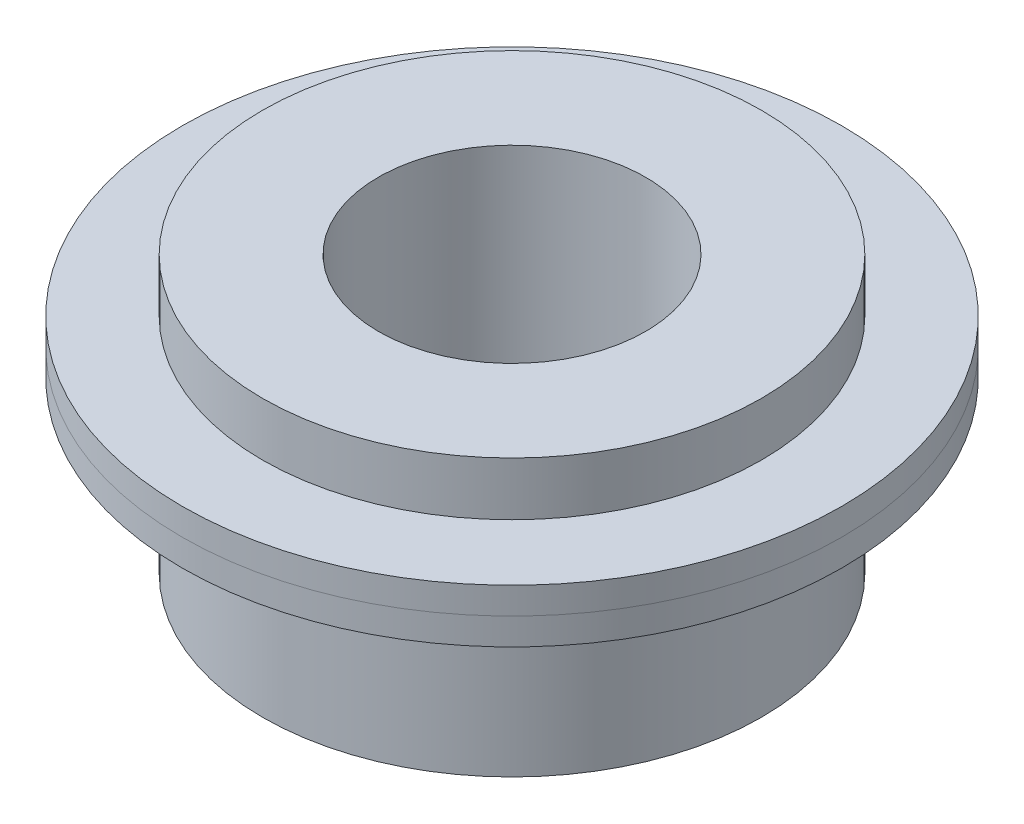
from build123d import *

# Parameters (mm, degrees)
SKETCH2_R           = 18.5
SKETCH2_R_2         = 14
BOSS_EXTRUDE1_DEPTH = 1.5


with BuildPart() as part:
    # Sketch1 → Revolve1 (revolve)
    with BuildSketch(Plane.XY, mode=Mode.PRIVATE) as revolve1_sk:
        Polygon((-7.5, 4.552980132), (-14, 4.552980132), (-14, 1.552980132), (-18.5, 1.552980132), (-18.5, 0.052980132), (-14, 0.052980132), (-14, -10.947019868), (-7.5, -10.947019868), align=None)
    revolve(revolve1_sk.sketch.rotate(Axis((0, 7.466887417, 0), (0, -1, 0)), 270), axis=Axis((0, 7.466887417, 0), (0, -1, 0)))


with BuildPart() as body_2:
    # Sketch2 → Boss-Extrude1 (new body)
    with BuildSketch(Plane.XZ.offset(-0.052980132)):
        with Locations(Location((0, 0, 0), (0, 0, 270))):
            Circle(SKETCH2_R)
        with Locations(Location((0, 0, 0), (0, 0, 270))):
            Circle(SKETCH2_R_2, mode=Mode.SUBTRACT)
    extrude(amount=BOSS_EXTRUDE1_DEPTH)


solid = Compound([part.part, body_2.part])
